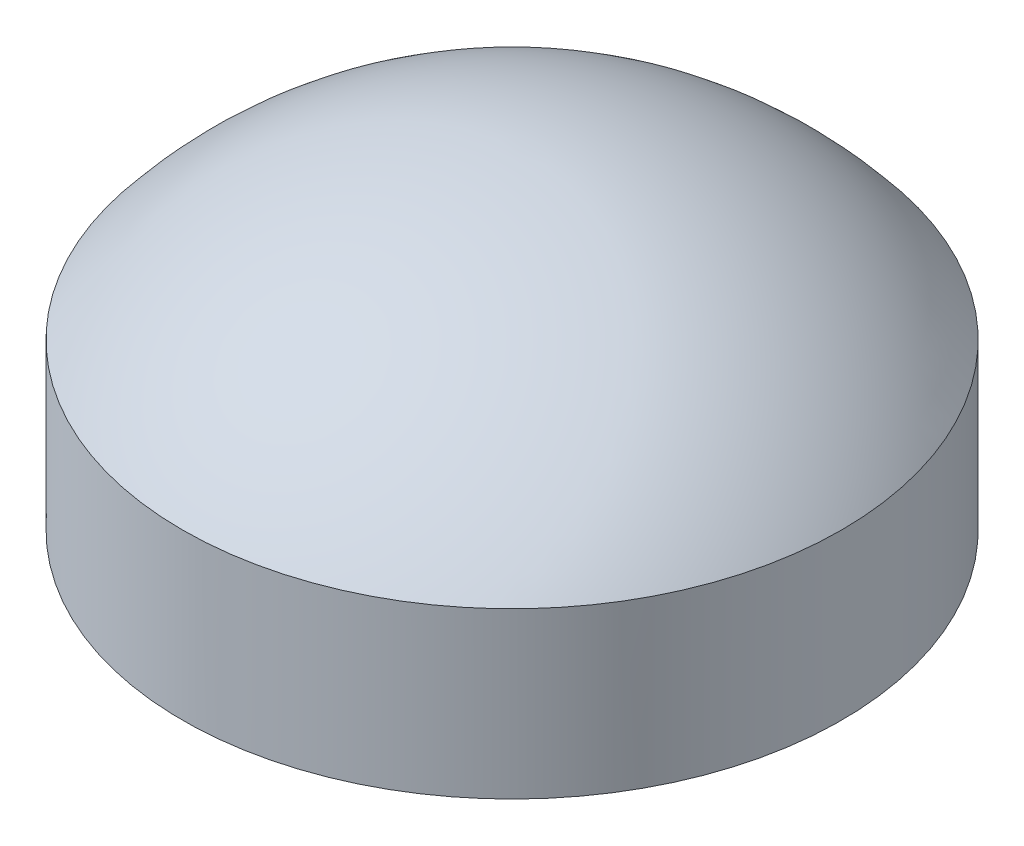
from build123d import *


with BuildPart() as part:
    # Sketch1 → Revolve1 (revolve)
    with BuildSketch(Plane.XY, mode=Mode.PRIVATE) as revolve1_sk:
        with BuildLine():
            Line((44.45, 25.4), (44.45, 0))
            Line((44.45, 0), (50.8, 0))
            Line((50.8, 0), (50.8, 17.05187202))
            ThreePointArc((50.8, 17.05187202), (47.807566715, 21.364805304), (44.45, 25.4))
        make_face()
        with BuildLine():
            ThreePointArc((0, 45.066317517), (24.303119885, 39.930145311), (44.45, 25.4))
            ThreePointArc((44.45, 25.4), (47.807566715, 21.364805304), (50.8, 17.05187202))
            Line((50.8, 17.05187202), (50.8, 25.4))
            ThreePointArc((50.8, 25.4), (28.201011733, 43.459412734), (0, 49.906086001))
            Line((0, 49.906086001), (0, 45.066317517))
        make_face()
    revolve(revolve1_sk.sketch.rotate(Axis((0, 0, 0), (0, 1, 0)), 90), axis=Axis((0, 0, 0), (0, 1, 0)))


solid = part.part
